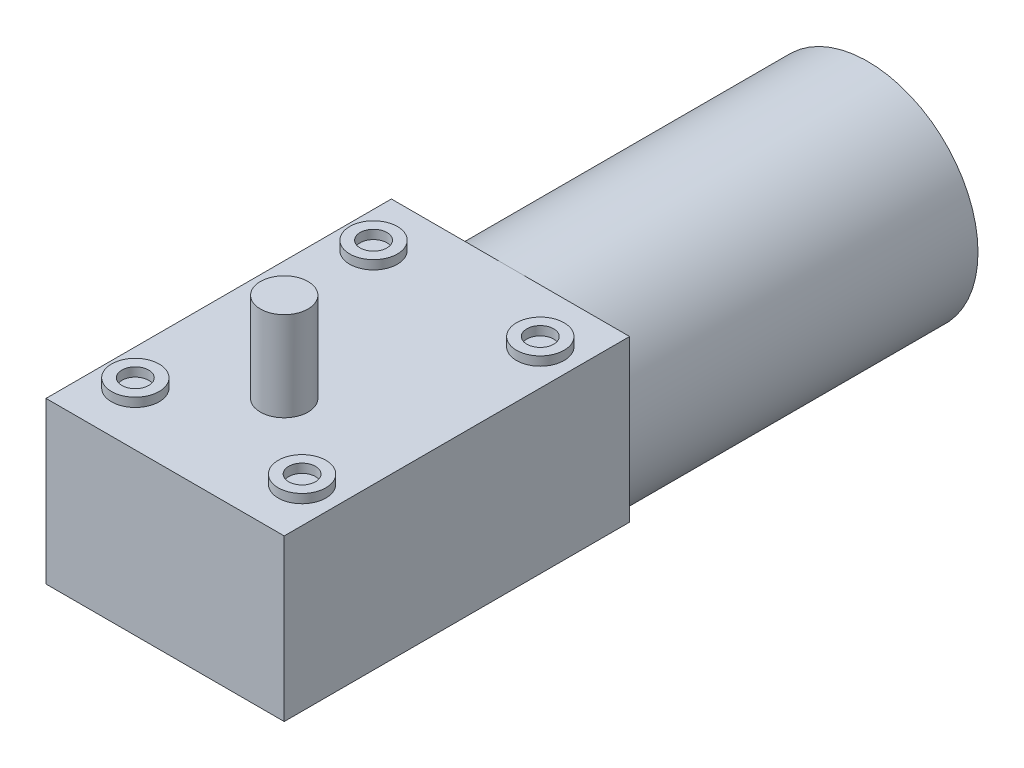
from build123d import *

# Parameters (mm, degrees)
SKETCH1_R               = 18.5
BOSS_EXTRUDE1_DEPTH     = 60
SKETCH2_W               = 40
SKETCH2_H               = 37
BOSS_EXTRUDE2_DEPTH     = 58
SKETCH3_R               = 4
BOSS_EXTRUDE3_DEPTH     = 15
CUT_EXTRUDE1_DEPTH      = 125.282943319
CUT_EXTRUDE1_DEPTH_BACK = 58
SKETCH4_W               = 40
SKETCH4_H               = 10
SKETCH5_R               = 4
SKETCH5_R_2             = 2.25
BOSS_EXTRUDE4_DEPTH     = 1.5


with BuildPart() as part:
    # Sketch1 → Boss-Extrude1 (new body)
    with BuildSketch(Plane.XY):
        Circle(SKETCH1_R)
    extrude(amount=BOSS_EXTRUDE1_DEPTH)

    # Sketch2 → Boss-Extrude2 (add)
    with BuildSketch(Plane.XY.offset(60)):
        Rectangle(SKETCH2_W, SKETCH2_H)
    extrude(amount=BOSS_EXTRUDE2_DEPTH)

    # Sketch3 → Boss-Extrude3 (add)
    with BuildSketch(Plane(origin=(0, 18.5, 0), x_dir=(1, 0, 0), z_dir=(0, 1, 0))):
        with Locations(Location((0, -98, 0), (0, 0, 90))):
            Circle(SKETCH3_R)
    extrude(amount=BOSS_EXTRUDE3_DEPTH)

    # Sketch4 → Cut-Extrude1 (cut, two sides: drawn at the far end of the back side and taken through both)
    with BuildSketch(Plane.XY.offset(118).offset(-CUT_EXTRUDE1_DEPTH_BACK)):
        with Locations((0, -13.5)):
            Rectangle(SKETCH4_W, SKETCH4_H)
    extrude(amount=CUT_EXTRUDE1_DEPTH + CUT_EXTRUDE1_DEPTH_BACK, mode=Mode.SUBTRACT)

    # Sketch5 → Boss-Extrude4 (add)
    # profile 1 of 4: a face of its own
    with BuildSketch(Plane(origin=(0, 18.5, 0), x_dir=(1, 0, 0), z_dir=(0, 1, 0))):
        with Locations(Location((14, -69, 0), (0, 0, 90))):
            Circle(SKETCH5_R)
        with Locations(Location((14, -69, 0), (0, 0, 270))):
            Circle(SKETCH5_R_2, mode=Mode.SUBTRACT)
    # profile 2 of 4: a face of its own
    with BuildSketch(Plane(origin=(0, 18.5, 0), x_dir=(1, 0, 0), z_dir=(0, 1, 0))):
        with Locations(Location((14, -109, 0), (0, 0, 90))):
            Circle(SKETCH5_R)
        with Locations(Location((14, -109, 0), (0, 0, 270))):
            Circle(SKETCH5_R_2, mode=Mode.SUBTRACT)
    # profile 3 of 4: a face of its own
    with BuildSketch(Plane(origin=(0, 18.5, 0), x_dir=(1, 0, 0), z_dir=(0, 1, 0))):
        with Locations(Location((-14, -109, 0), (0, 0, 90))):
            Circle(SKETCH5_R)
        with Locations(Location((-14, -109, 0), (0, 0, 90))):
            Circle(SKETCH5_R_2, mode=Mode.SUBTRACT)
    # profile 4 of 4: a face of its own
    with BuildSketch(Plane(origin=(0, 18.5, 0), x_dir=(1, 0, 0), z_dir=(0, 1, 0))):
        with Locations(Location((-14, -69, 0), (0, 0, 90))):
            Circle(SKETCH5_R)
        with Locations(Location((-14, -69, 0), (0, 0, 90))):
            Circle(SKETCH5_R_2, mode=Mode.SUBTRACT)
    extrude(amount=BOSS_EXTRUDE4_DEPTH)


solid = part.part
